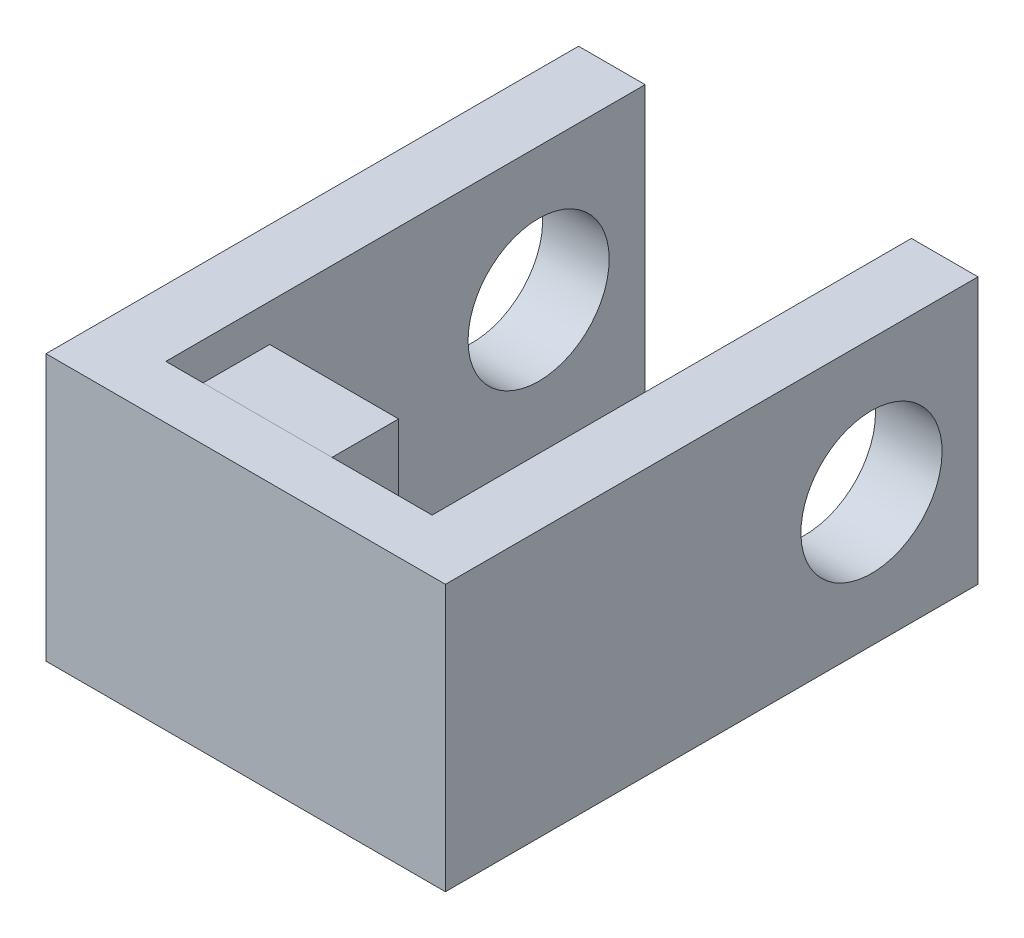
from build123d import *

# Parameters (mm, degrees)
SKETCH1_W           = 15
SKETCH1_H           = 10
BOSS_EXTRUDE1_DEPTH = 2
SKETCH2_W           = 2.5
SKETCH2_H           = 10
BOSS_EXTRUDE2_DEPTH = 18
SKETCH3_R           = 2.65
CUT_EXTRUDE1_DEPTH  = 26.475478406
SKETCH4_W           = 4.841644851
SKETCH4_H           = 10
BOSS_EXTRUDE3_DEPTH = 2.5


with BuildPart() as part:
    # Sketch1 → Boss-Extrude1 (new body)
    with BuildSketch(Plane.XY):
        with Locations((7.5, 5)):
            Rectangle(SKETCH1_W, SKETCH1_H)
    extrude(amount=BOSS_EXTRUDE1_DEPTH)

    # Sketch2 → Boss-Extrude2 (add)
    with BuildSketch(Plane(origin=(0, 0, 0), x_dir=(-1, 0, 0), z_dir=(0, 0, -1))):
        with Locations((-13.75, 5)):
            Rectangle(SKETCH2_W, SKETCH2_H)
        with Locations((-1.25, 5)):
            Rectangle(SKETCH2_W, SKETCH2_H)
    extrude(amount=BOSS_EXTRUDE2_DEPTH)

    # Sketch3 → Cut-Extrude1 (cut, through all)
    with BuildSketch(Plane(origin=(15, 0, 0), x_dir=(0, 0, -1), z_dir=(1, 0, 0))):
        with Locations(Location((14, 5, 0), (0, 0, 90))):
            Circle(SKETCH3_R)
    extrude(amount=-CUT_EXTRUDE1_DEPTH, mode=Mode.SUBTRACT)


with BuildPart() as body_2:
    # Sketch4 → Boss-Extrude3 (new body)
    with BuildSketch(Plane(origin=(0, 0, 0), x_dir=(-1, 0, 0), z_dir=(0, 0, -1))):
        with Locations((-6.320822426, 5)):
            Rectangle(SKETCH4_W, SKETCH4_H)
    extrude(amount=BOSS_EXTRUDE3_DEPTH)


solid = Compound([part.part, body_2.part])
